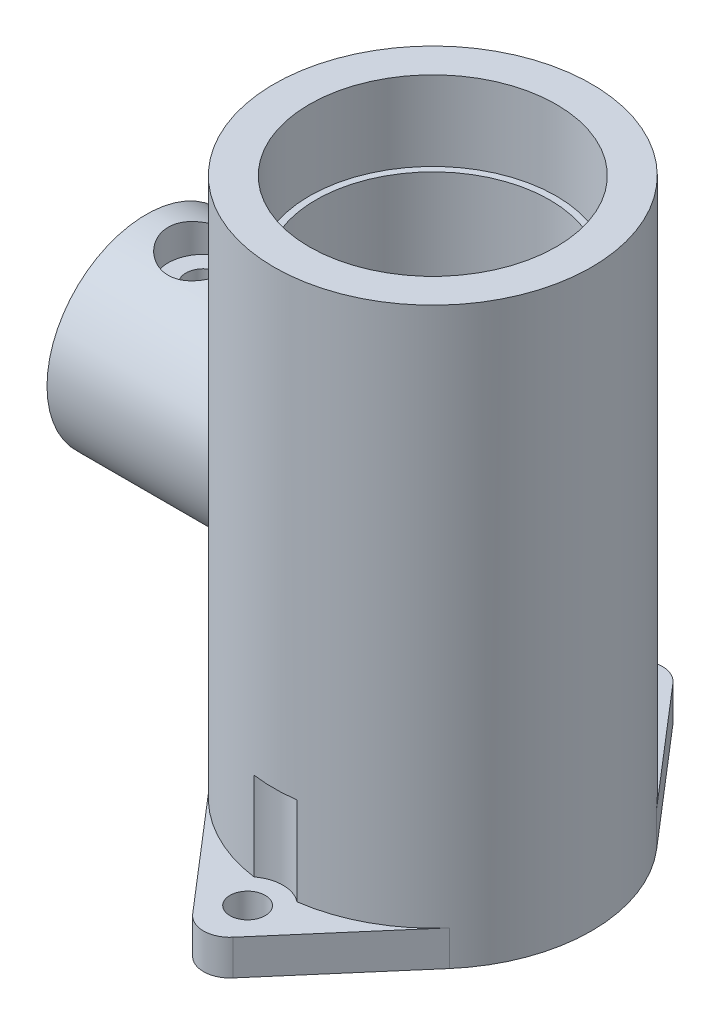
from build123d import *

# Parameters (mm, degrees)
ESQUISSE1_R                                = 18
BOSS_EXTRU_1_DEPTH                         = 65.18
BOSS_EXTRU_3_DEPTH                         = 6
BOSS_EXTRU_3_DEPTH_BACK                    = 16
ESQUISSE2_R                                = 11.25
ESQUISSE3_R                                = 4.8
ENL_V_MAT_EXTRU_1_DEPTH                    = 13
ESQUISSE4_R                                = 14
ENL_V_MAT_EXTRU_2_DEPTH                    = 9
ESQUISSE5_R                                = 10
ENL_V_MAT_EXTRU_3_DEPTH                    = 68.353117384
BOSS_EXTRU_4_DEPTH                         = 4
ESQUISSE9_R                                = 2
ENL_V_MAT_EXTRU_4_DEPTH                    = 74.994881031
ESQUISSE11_R                               = 4
ENL_V_MAT_EXTRU_5_DEPTH                    = 3.5
ESQUISSE12_R                               = 2
ENL_V_MAT_EXTRU_6_DEPTH                    = 3.5
SYM_TRIE4_AT_THE_SECOND_PLANE_COPY_1_SKE_R = 4
SYM_TRIE4_AT_THE_SECOND_PLANE_COPY_1_DEPTH = 3.5
SYM_TRIE4_AT_THE_SECOND_PLANE_COPY_2_SKE_R = 2
SYM_TRIE4_AT_THE_SECOND_PLANE_COPY_2_DEPTH = 3.5
ESQUISSE13_R                               = 13.25
ENL_V_MAT_EXTRU_7_DEPTH                    = 75
ENL_V_MAT_EXTRU_8_DEPTH                    = 10


with BuildPart() as part:
    # Esquisse1 → Boss.-Extru.1 (new body)
    with BuildSketch(Plane(origin=(0, 0, 0), x_dir=(1, 0, 0), z_dir=(0, 1, 0))):
        with Locations(Location((0, 0, 0), (0, 0, 270))):
            Circle(ESQUISSE1_R)
    extrude(amount=BOSS_EXTRU_1_DEPTH)

    # Esquisse2 → Boss.-Extru.3 (add, two sides: drawn at the far end of the back side and taken through both)
    with BuildSketch(Plane(origin=(-16.5, 0, 0), x_dir=(0, 0, -1), z_dir=(1, 0, 0)).offset(-BOSS_EXTRU_3_DEPTH_BACK)):
        with Locations((0, 33.87)):
            Circle(ESQUISSE2_R)
    extrude(amount=BOSS_EXTRU_3_DEPTH + BOSS_EXTRU_3_DEPTH_BACK)

    # Esquisse3 → Enlèv. mat.-Extru.1 (cut)
    with BuildSketch(Plane.ZY.offset(32.5)):
        with Locations((0, 33.87)):
            Circle(ESQUISSE3_R)
    extrude(amount=-ENL_V_MAT_EXTRU_1_DEPTH, mode=Mode.SUBTRACT)

    # Esquisse4 → Enlèv. mat.-Extru.2 (cut)
    with BuildSketch(Plane(origin=(0, 65.18, 0), x_dir=(1, 0, 0), z_dir=(0, 1, 0))):
        with Locations(Location((0, 0, 0), (0, 0, 270))):
            Circle(ESQUISSE4_R)
    extrude(amount=-ENL_V_MAT_EXTRU_2_DEPTH, mode=Mode.SUBTRACT)

    # Esquisse5 → Enlèv. mat.-Extru.3 (cut, through all)
    with BuildSketch(Plane(origin=(0, 56.18, 0), x_dir=(1, 0, 0), z_dir=(0, 1, 0))):
        with Locations(Location((0, 0, 0), (0, 0, 270))):
            Circle(ESQUISSE5_R)
    extrude(amount=-ENL_V_MAT_EXTRU_3_DEPTH, mode=Mode.SUBTRACT)

    # Esquisse8 → Boss.-Extru.4 (add)
    with BuildSketch(Plane(origin=(0, 0, 0), x_dir=(1, 0, 0), z_dir=(0, 1, 0))):
        with BuildLine():
            Line((13.645248867, 11.739130435), (2.274208144, 24.956521739))
            ThreePointArc((2.274208144, 24.956521739), (0, 26), (-2.274208144, 24.956521739))
            Line((-2.274208144, 24.956521739), (-13.645248867, 11.739130435))
            ThreePointArc((-13.645248867, 11.739130435), (0, 18), (13.645248867, 11.739130435))
        make_face()
    boss_extru_4 = extrude(amount=BOSS_EXTRU_4_DEPTH)

    # Esquisse9 → Enlèv. mat.-Extru.4 (cut, through all)
    with BuildSketch(Plane(origin=(0, 4, 0), x_dir=(1, 0, 0), z_dir=(0, 1, 0))):
        with Locations(Location((0, 21, 0), (0, 0, 270))):
            Circle(ESQUISSE9_R)
    enl_v_mat_extru_4 = extrude(amount=-ENL_V_MAT_EXTRU_4_DEPTH, mode=Mode.SUBTRACT)

    # Symétrie3: Boss.-Extru.4, Enlèv. mat.-Extru.4 across plane
    add(boss_extru_4.mirror(Plane(origin=(0, 0, 0), x_dir=(0, 0, 1), z_dir=(1, 0, 0))))
    add(enl_v_mat_extru_4.mirror(Plane(origin=(0, 0, 0), x_dir=(0, 0, 1), z_dir=(1, 0, 0))), mode=Mode.SUBTRACT)

    # Symétrie3 at the second plane: Boss.-Extru.4, Enlèv. mat.-Extru.4 across plane
    add(boss_extru_4.mirror(Plane.XY))
    add(enl_v_mat_extru_4.mirror(Plane.XY), mode=Mode.SUBTRACT)

    # Esquisse11 → Enlèv. mat.-Extru.5 (cut)
    with BuildSketch(Plane(origin=(0, 45.12, 0), x_dir=(1, 0, 0), z_dir=(0, 1, 0))):
        with Locations(Location((-26, 0, 0), (0, 0, 270))):
            Circle(ESQUISSE11_R)
    enl_v_mat_extru_5 = extrude(amount=-ENL_V_MAT_EXTRU_5_DEPTH, mode=Mode.SUBTRACT)

    # Esquisse12 → Enlèv. mat.-Extru.6 (cut)
    with BuildSketch(Plane(origin=(0, 41.62, 0), x_dir=(1, 0, 0), z_dir=(0, 1, 0))):
        with Locations(Location((-26, 0, 0), (0, 0, 270))):
            Circle(ESQUISSE12_R)
    enl_v_mat_extru_6 = extrude(amount=-ENL_V_MAT_EXTRU_6_DEPTH, mode=Mode.SUBTRACT)

    # Symétrie4: Enlèv. mat.-Extru.5, Enlèv. mat.-Extru.6 across plane
    add(enl_v_mat_extru_5.mirror(Plane.XY), mode=Mode.SUBTRACT)
    add(enl_v_mat_extru_6.mirror(Plane.XY), mode=Mode.SUBTRACT)

    # Symétrie4 at the second plane: Enlèv. mat.-Extru.5, Enlèv. mat.-Extru.6 across plane
    add(enl_v_mat_extru_5.mirror(Plane.ZX.offset(33.87)), mode=Mode.SUBTRACT)
    add(enl_v_mat_extru_6.mirror(Plane.ZX.offset(33.87)), mode=Mode.SUBTRACT)

    # Symétrie4 at the second plane copy 1 ske → Symétrie4 at the second plane copy 1 (cut)
    with BuildSketch(Plane.XZ.offset(-22.62)):
        with Locations(Location((-26, 0, 0), (0, 0, 270))):
            Circle(SYM_TRIE4_AT_THE_SECOND_PLANE_COPY_1_SKE_R)
    extrude(amount=-SYM_TRIE4_AT_THE_SECOND_PLANE_COPY_1_DEPTH, mode=Mode.SUBTRACT)

    # Symétrie4 at the second plane copy 2 ske → Symétrie4 at the second plane copy 2 (cut)
    with BuildSketch(Plane.XZ.offset(-26.12)):
        with Locations(Location((-26, 0, 0), (0, 0, 270))):
            Circle(SYM_TRIE4_AT_THE_SECOND_PLANE_COPY_2_SKE_R)
    extrude(amount=-SYM_TRIE4_AT_THE_SECOND_PLANE_COPY_2_DEPTH, mode=Mode.SUBTRACT)

    # Esquisse13 → Enlèv. mat.-Extru.7 (cut)
    with BuildSketch(Plane.XZ):
        with Locations(Location((0, 0, 0), (0, 0, 270))):
            Circle(ESQUISSE13_R)
    extrude(amount=-ENL_V_MAT_EXTRU_7_DEPTH, mode=Mode.SUBTRACT)

    # Esquisse14 → Enlèv. mat.-Extru.8 (cut)
    with BuildSketch(Plane(origin=(0, 4, 0), x_dir=(1, 0, 0), z_dir=(0, 1, 0))):
        with BuildLine():
            ThreePointArc((-2.44381305, -17.833333333), (0, -17), (2.44381305, -17.833333333))
            ThreePointArc((2.44381305, -17.833333333), (0, -18), (-2.44381305, -17.833333333))
        make_face()
    enl_v_mat_extru_8 = extrude(amount=ENL_V_MAT_EXTRU_8_DEPTH, mode=Mode.SUBTRACT)

    # Symétrie5: Enlèv. mat.-Extru.8 across plane
    add(enl_v_mat_extru_8.mirror(Plane.XY), mode=Mode.SUBTRACT)


solid = part.part
